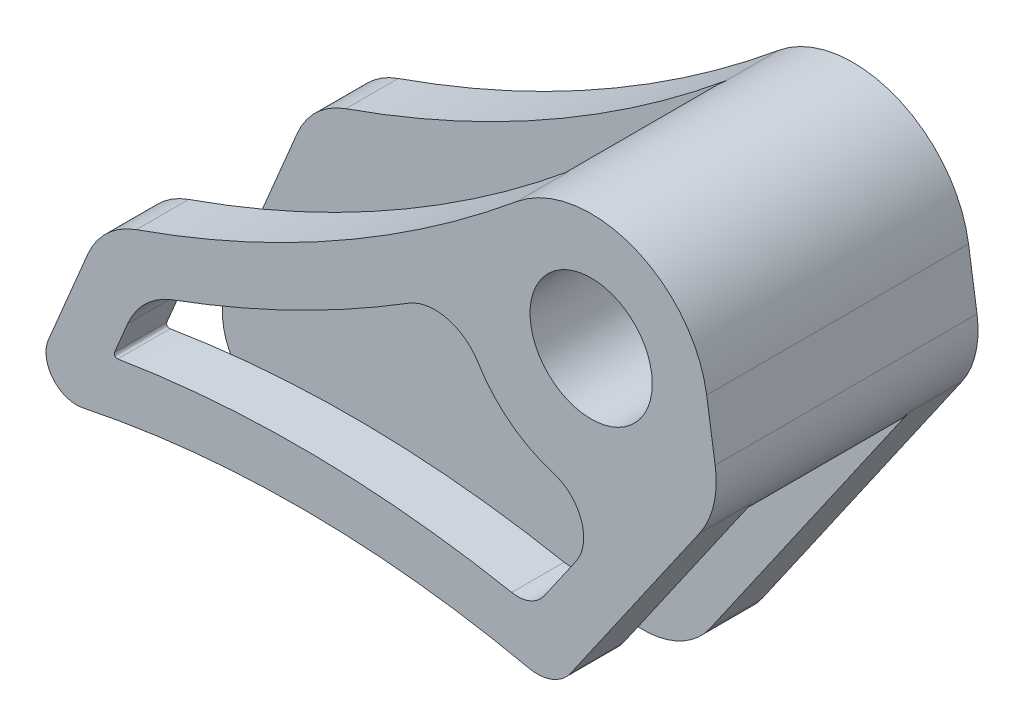
from build123d import *

# Parameters (mm, degrees)
BOSS_EXTRUDE1_DEPTH     = 15
SKETCH16_R              = 2.1
CUT_EXTRUDE2_DEPTH      = 89.504764277
SKETCH17_R              = 3.5
CUT_EXTRUDE3_DEPTH      = 5
CUT_EXTRUDE1_DEPTH      = 5
CUT_EXTRUDE1_DEPTH_BACK = 4
CUT_EXTRUDE5_DEPTH      = 3
CUT_EXTRUDE4_DEPTH      = 3


with BuildPart() as part:
    # Sketch14 → Boss-Extrude1 (new body)
    with BuildSketch(Plane.XY):
        with BuildLine():
            Line((-16.161413536, 57.977264022), (-12.181084948, 67.464973009))
            ThreePointArc((-12.181084948, 67.464973009), (-11.065698538, 69.072353645), (-9.393028071, 70.087209723))
            ThreePointArc((-9.393028071, 70.087209723), (2.046505069, 75.260844547), (12.392283809, 82.373810035))
            ThreePointArc((12.392283809, 82.373810035), (19.046410902, 83.46789097), (23.273577081, 78.213798608))
            Line((23.273577081, 78.213798608), (23.760338244, 74.979563376))
            ThreePointArc((23.760338244, 74.979563376), (23.681286202, 72.988596756), (22.8727833, 71.167465139))
            Line((22.8727833, 71.167465139), (11.475608136, 54.751856173))
            ThreePointArc((11.475608136, 54.751856173), (9.468702378, 53.12015601), (6.90080904, 52.810252891))
            ThreePointArc((6.90080904, 52.810252891), (-2.49021647, 53.523672844), (-11.865953559, 52.631550555))
            ThreePointArc((-11.865953559, 52.631550555), (-15.60520233, 54.025568594), (-16.161413536, 57.977264022))
        make_face()
    extrude(amount=BOSS_EXTRUDE1_DEPTH)

    # Sketch16 → Cut-Extrude2 (cut, through all)
    with BuildSketch(Plane.XY.offset(15)):
        with Locations((16.657019892, 77.21798883)):
            Circle(SKETCH16_R)
    extrude(amount=-CUT_EXTRUDE2_DEPTH, mode=Mode.SUBTRACT)

    # Sketch17 → Cut-Extrude3 (cut)
    with BuildSketch(Plane.XY.offset(15)):
        with Locations((16.657019892, 77.21798883)):
            Circle(SKETCH17_R)
    extrude(amount=-CUT_EXTRUDE3_DEPTH, mode=Mode.SUBTRACT)

    # Sketch15 → Cut-Extrude1 (cut, two sides: drawn at the far end of the back side and taken through both)
    with BuildSketch(Plane.XY.offset(7).offset(-CUT_EXTRUDE1_DEPTH_BACK)):
        with BuildLine():
            Line((13.708420325, 83.2243377), (11.92660987, 87.484761825))
            Line((11.92660987, 87.484761825), (-22.331697338, 87.484761825))
            Line((-22.331697338, 87.484761825), (-22.331697338, 56.566228638))
            Line((-22.331697338, 56.566228638), (-22.331697338, 46.478853626))
            Line((-22.331697338, 46.478853626), (13.179214544, 46.478853626))
            Line((13.179214544, 46.478853626), (31.832474143, 71.167465139))
            Line((31.832474143, 71.167465139), (22.8727833, 71.167465139))
            ThreePointArc((22.8727833, 71.167465139), (19.43169391, 68.968964182), (15.448675977, 69.869003519))
            Line((15.448675977, 69.869003519), (12.782241645, 71.763031479))
            ThreePointArc((12.782241645, 71.763031479), (9.987686622, 77.756932137), (13.708420325, 83.2243377))
        make_face()
    extrude(amount=CUT_EXTRUDE1_DEPTH + CUT_EXTRUDE1_DEPTH_BACK, mode=Mode.SUBTRACT)

    # Sketch19 → Cut-Extrude5 (cut)
    with BuildSketch(Plane.XY.offset(15)):
        with BuildLine():
            Line((-14.431982215, 62.099622447), (-17.748305782, 61.423635141))
            Line((-17.748305782, 61.423635141), (-17.748305782, 50.845501907))
            Line((-17.748305782, 50.845501907), (18.748185883, 50.845501907))
            Line((18.748185883, 50.845501907), (18.748185883, 60.53099213))
            Line((18.748185883, 60.53099213), (15.487998108, 60.53099213))
            ThreePointArc((15.487998108, 60.53099213), (14.424069998, 59.689920639), (13.072075611, 59.582890491))
            ThreePointArc((13.072075611, 59.582890491), (0.311109574, 60.999206641), (-12.463639277, 59.713128338))
            ThreePointArc((-12.463639277, 59.713128338), (-14.168682333, 60.311811806), (-14.431982215, 62.099622447))
        make_face()
    extrude(amount=-CUT_EXTRUDE5_DEPTH, mode=Mode.SUBTRACT)

    # Sketch18 → Cut-Extrude4 (cut)
    with BuildSketch(Plane.XY.offset(15)):
        with BuildLine():
            Line((-9.882439649, 65.189392999), (-10.64394248, 63.374237016))
            ThreePointArc((-10.64394248, 63.374237016), (-10.620440593, 63.202263891), (-10.458545604, 63.139677097))
            ThreePointArc((-10.458545604, 63.139677097), (0.83913118, 63.994498661), (12.110509679, 62.84373919))
            ThreePointArc((12.110509679, 62.84373919), (13.150600921, 62.946203076), (13.96631504, 63.599578248))
            Line((13.96631504, 63.599578248), (15.793536168, 66.231366135))
            ThreePointArc((15.793536168, 66.231366135), (16.091647066, 68.426370752), (14.489067204, 69.955636315))
            ThreePointArc((14.489067204, 69.955636315), (12.025965625, 71.21839557), (10.180541593, 73.281364419))
            ThreePointArc((10.180541593, 73.281364419), (8.387287086, 74.587638576), (6.197252886, 74.232865263))
            ThreePointArc((6.197252886, 74.232865263), (-0.388803899, 70.594783201), (-7.311073103, 67.646228619))
            ThreePointArc((-7.311073103, 67.646228619), (-8.85277752, 66.685766956), (-9.882439649, 65.189392999))
        make_face()
    extrude(amount=-CUT_EXTRUDE4_DEPTH, mode=Mode.SUBTRACT)


solid = part.part
